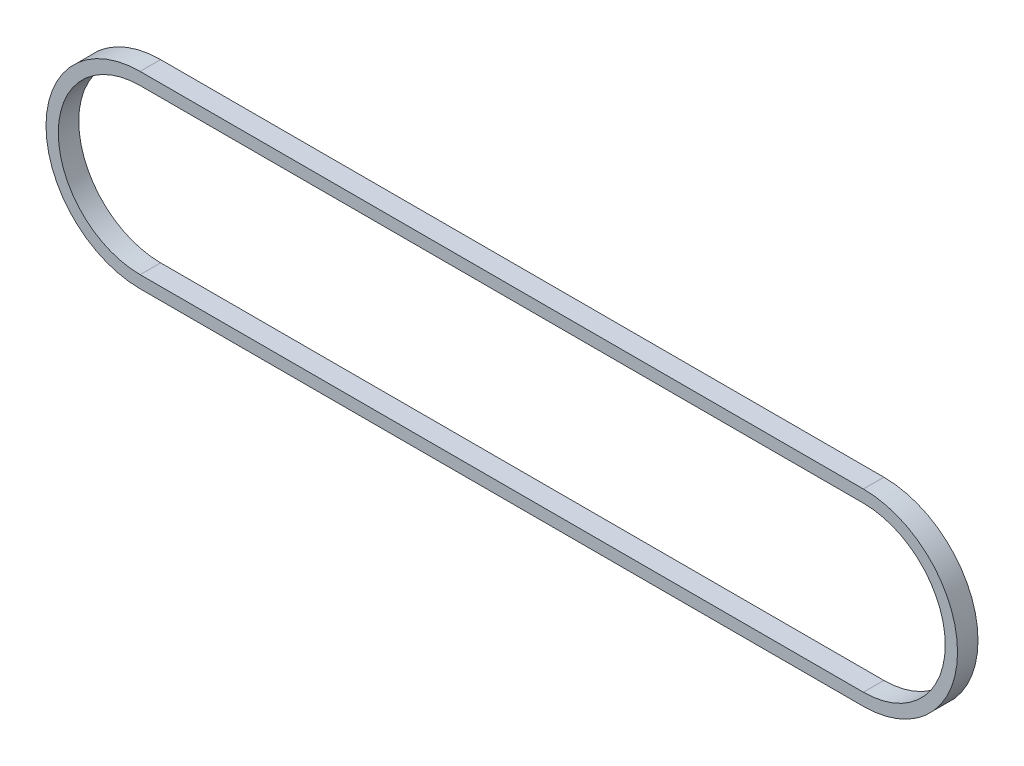
from build123d import *

# Parameters (mm, degrees)
BOSS_EXTRUDE1_DEPTH = 2.5


with BuildPart() as part:
    # Sketch1 → Boss-Extrude1 (new, symmetric)
    with BuildSketch(Plane.XY):
        with BuildLine():
            Line((88.35, -23), (-88.35, -23))
            ThreePointArc((-88.35, -23), (-111.35, 0), (-88.35, 23))
            Line((-88.35, 23), (88.35, 23))
            ThreePointArc((88.35, 23), (111.35, 0), (88.35, -23))
        make_face()
        with BuildLine():
            Line((88.35, -20), (-88.35, -20))
            ThreePointArc((-88.35, -20), (-108.35, 0), (-88.35, 20))
            Line((-88.35, 20), (88.35, 20))
            ThreePointArc((88.35, 20), (108.35, 0), (88.35, -20))
        make_face(mode=Mode.SUBTRACT)
    extrude(amount=BOSS_EXTRUDE1_DEPTH, both=True)


solid = part.part
